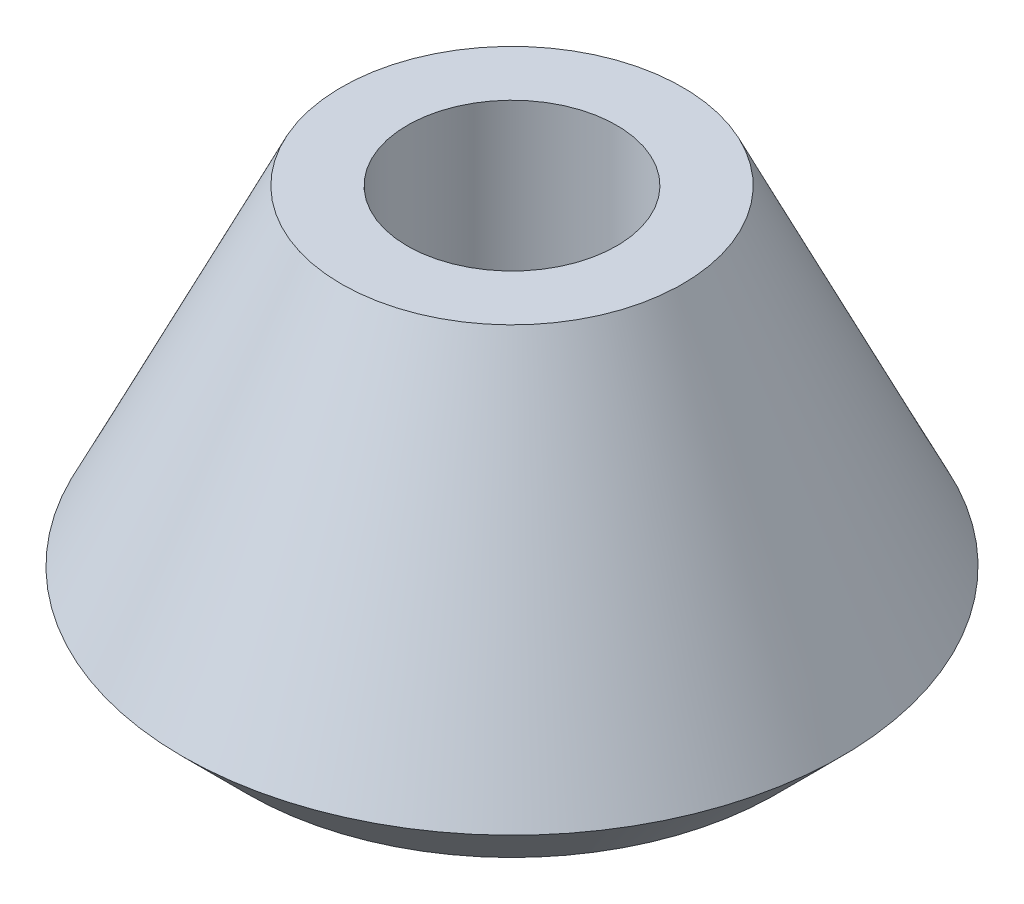
from build123d import *


with BuildPart() as part:
    # Sketch1 → Revolve1 (revolve)
    with BuildSketch(Plane.XY, mode=Mode.PRIVATE) as revolve1_sk:
        Polygon((7.9375, 0), (7.9375, 30), (12.9375, 30), (25, 5), (20, 0), align=None)
    revolve(revolve1_sk.sketch.rotate(Axis((0, 4.048125, 0), (0, -1, 0)), 90), axis=Axis((0, 4.048125, 0), (0, -1, 0)))


solid = part.part
